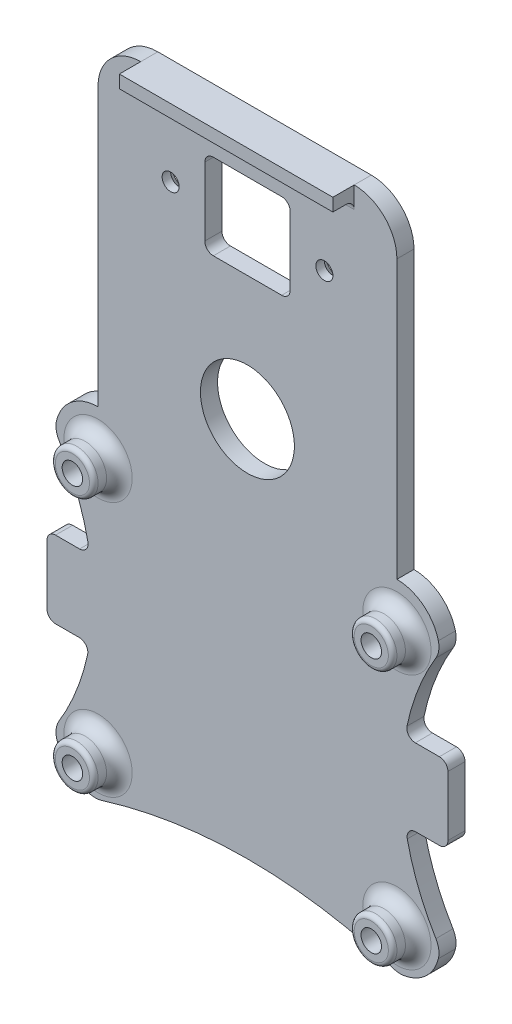
from build123d import *

# Parameters (mm, degrees)
SKETCH1_R           = 2.4
BOSS_EXTRUDE1_DEPTH = 4
SKETCH2_R           = 5.004606442
SKETCH2_R_2         = 2.4
SKETCH2_R_3         = 5
BOSS_EXTRUDE2_DEPTH = 6
FILLET1_R           = 3
FILLET2_R           = 1
FILLET3_R           = 5
BOSS_EXTRUDE3_DEPTH = 4
CUT_EXTRUDE1_REACH  = 126.617
SKETCH4_R           = 2
SKETCH4_R_2         = 11
CHAMFER2_SIZE       = 2
SKETCH5_W           = 50
SKETCH5_H           = 3
BOSS_EXTRUDE4_DEPTH = 5
FILLET4_R           = 2


with BuildPart() as part:
    # Sketch1 → Boss-Extrude1 (new body)
    with BuildSketch(Plane.XY):
        with BuildLine():
            Line((-35, 40), (35, 40))
            ThreePointArc((35, 40), (42.071067812, 37.071067812), (45, 30))
            ThreePointArc((45, 30), (40.324654416, 21.056464988), (37.362127592, 11.409231724))
            ThreePointArc((37.362127592, 11.409231724), (37.76764229, 9.738743374), (39.319812295, 9))
            Line((39.319812295, 9), (44.95, 9))
            ThreePointArc((44.95, 9), (46.364213562, 8.414213562), (46.95, 7))
            Line((46.95, 7), (46.95, -7))
            ThreePointArc((46.95, -7), (46.364213562, -8.414213562), (44.95, -9))
            Line((44.95, -9), (39.385736873, -9))
            ThreePointArc((39.385736873, -9), (37.829794408, -9.743400205), (37.43053989, -11.420956955))
            ThreePointArc((37.43053989, -11.420956955), (40.387514205, -20.898098851), (45, -29.689281388))
            ThreePointArc((45, -29.689281388), (42.158200619, -36.675130552), (35.244966425, -39.689281388))
            ThreePointArc((35.244966425, -39.689281388), (0.122483213, -34.194583419), (-35, -39.689281388))
            ThreePointArc((-35, -39.689281388), (-42.071067812, -36.7603492), (-45, -29.689281388))
            ThreePointArc((-45, -29.689281388), (-40.387514205, -20.898098851), (-37.43053989, -11.420956955))
            ThreePointArc((-37.43053989, -11.420956955), (-37.829794408, -9.743400205), (-39.385736873, -9))
            Line((-39.385736873, -9), (-44.95, -9))
            ThreePointArc((-44.95, -9), (-46.364213562, -8.414213562), (-46.95, -7))
            Line((-46.95, -7), (-46.95, 7))
            ThreePointArc((-46.95, 7), (-46.364213562, 8.414213562), (-44.95, 9))
            Line((-44.95, 9), (-39.319812295, 9))
            ThreePointArc((-39.319812295, 9), (-37.76764229, 9.738743374), (-37.362127592, 11.409231724))
            ThreePointArc((-37.362127592, 11.409231724), (-40.324654416, 21.056464988), (-45, 30))
            ThreePointArc((-45, 30), (-42.071067812, 37.071067812), (-35, 40))
        make_face()
        with Locations((-35, 29.5)):
            Circle(SKETCH1_R, mode=Mode.SUBTRACT)
        with Locations((35, 29.5)):
            Circle(SKETCH1_R, mode=Mode.SUBTRACT)
        with Locations((-35, -30.3)):
            Circle(SKETCH1_R, mode=Mode.SUBTRACT)
        with Locations((35, -30.3)):
            Circle(SKETCH1_R, mode=Mode.SUBTRACT)
    extrude(amount=BOSS_EXTRUDE1_DEPTH)

    # Sketch2 → Boss-Extrude2 (add)
    # profile 1 of 4: a face of its own
    with BuildSketch(Plane.XY.offset(4)):
        with Locations(Location((-35, 29.5, 0), (0, 0, 180))):
            Circle(SKETCH2_R)
        with Locations((-35, 29.5)):
            Circle(SKETCH2_R_2, mode=Mode.SUBTRACT)
    # profile 2 of 4: a face of its own
    with BuildSketch(Plane.XY.offset(4)):
        with Locations(Location((35, 29.5, 0), (0, 0, 180))):
            Circle(SKETCH2_R_3)
        with Locations((35, 29.5)):
            Circle(SKETCH2_R_2, mode=Mode.SUBTRACT)
    # profile 3 of 4: a face of its own
    with BuildSketch(Plane.XY.offset(4)):
        with Locations(Location((-35, -30.3, 0), (0, 0, 180))):
            Circle(SKETCH2_R_3)
        with Locations((-35, -30.3)):
            Circle(SKETCH2_R_2, mode=Mode.SUBTRACT)
    # profile 4 of 4: a face of its own
    with BuildSketch(Plane.XY.offset(4)):
        with Locations(Location((35, -30.3, 0), (0, 0, 180))):
            Circle(SKETCH2_R_3)
        with Locations((35, -30.3)):
            Circle(SKETCH2_R_2, mode=Mode.SUBTRACT)
    extrude(amount=BOSS_EXTRUDE2_DEPTH)

    # Fillet1
    fillet1_edges = [part.edges().sort_by_distance(p)[0] for p in [
        (-29.995393558, 29.5, 4),
        (40, 29.5, 4),
        (-30, -30.3, 4),
        (40, -30.3, 4),
    ]]
    fillet(fillet1_edges, radius=FILLET1_R)

    # Fillet2
    fillet2_edges = [part.edges().sort_by_distance(p)[0] for p in [
        (-29.995393558, 29.5, 10),
        (40, 29.5, 10),
        (-30, -30.3, 10),
        (40, -30.3, 10),
    ]]
    fillet(fillet2_edges, radius=FILLET2_R)

    # Fillet3
    fillet3_edges = [part.edges().sort_by_distance(p)[0] for p in [
        (45, 30, 2),
        (45, -29.689281388, 2),
        (35.244966425, -39.689281388, 2),
        (-35, -39.689281388, 2),
        (-45, -29.689281388, 2),
        (-45, 30, 2),
    ]]
    fillet(fillet3_edges, radius=FILLET3_R)

    # Sketch3 → Boss-Extrude3 (add)
    with BuildSketch(Plane(origin=(0, 0, 0), x_dir=(-1, 0, 0), z_dir=(0, 0, -1))):
        with BuildLine():
            Line((-35, 40), (35, 40))
            Line((35, 40), (35, 105))
            ThreePointArc((35, 105), (32.071067812, 112.071067812), (25, 115))
            Line((25, 115), (-25, 115))
            ThreePointArc((-25, 115), (-32.071067812, 112.071067812), (-35, 105))
            Line((-35, 105), (-35, 40))
        make_face()
    extrude(amount=-BOSS_EXTRUDE3_DEPTH)

    # Sketch4 → Cut-Extrude1 (cut, up to next)
    with BuildSketch(Plane(origin=(0, 0, 0), x_dir=(-1, 0, 0), z_dir=(0, 0, -1)), mode=Mode.PRIVATE) as cut_extrude1_sk1:
        with Locations((-18.012077439, 94.13)):
            Circle(SKETCH4_R)
    cut_extrude1_tool1 = extrude(cut_extrude1_sk1.sketch, amount=-CUT_EXTRUDE1_REACH, mode=Mode.PRIVATE) & part.part
    # Sketch4 → Cut-Extrude1 (cut, up to next)
    with BuildSketch(Plane(origin=(0, 0, 0), x_dir=(-1, 0, 0), z_dir=(0, 0, -1)), mode=Mode.PRIVATE) as cut_extrude1_sk2:
        with Locations((17.987922561, 94.13)):
            Circle(SKETCH4_R)
    cut_extrude1_tool2 = extrude(cut_extrude1_sk2.sketch, amount=-CUT_EXTRUDE1_REACH, mode=Mode.PRIVATE) & part.part
    # Sketch4 → Cut-Extrude1 (cut, up to next)
    with BuildSketch(Plane(origin=(0, 0, 0), x_dir=(-1, 0, 0), z_dir=(0, 0, -1)), mode=Mode.PRIVATE) as cut_extrude1_sk3:
        with Locations((0.010567412, 54.999350628)):
            Circle(SKETCH4_R_2)
    cut_extrude1_tool3 = extrude(cut_extrude1_sk3.sketch, amount=-CUT_EXTRUDE1_REACH, mode=Mode.PRIVATE) & part.part
    # Sketch4 → Cut-Extrude1 (cut, up to next)
    with BuildSketch(Plane(origin=(0, 0, 0), x_dir=(-1, 0, 0), z_dir=(0, 0, -1)), mode=Mode.PRIVATE) as cut_extrude1_sk4:
        with BuildLine():
            Line((-8.012077439, 84.13), (7.987922561, 84.13))
            ThreePointArc((7.987922561, 84.13), (9.402136123, 84.715786438), (9.987922561, 86.13))
            Line((9.987922561, 86.13), (9.987922561, 102.13))
            ThreePointArc((9.987922561, 102.13), (9.402136123, 103.544213562), (7.987922561, 104.13))
            Line((7.987922561, 104.13), (-8.012077439, 104.13))
            ThreePointArc((-8.012077439, 104.13), (-9.426291001, 103.544213562), (-10.012077439, 102.13))
            Line((-10.012077439, 102.13), (-10.012077439, 86.13))
            ThreePointArc((-10.012077439, 86.13), (-9.426291001, 84.715786438), (-8.012077439, 84.13))
        make_face()
    cut_extrude1_tool4 = extrude(cut_extrude1_sk4.sketch, amount=-CUT_EXTRUDE1_REACH, mode=Mode.PRIVATE) & part.part
    add(cut_extrude1_tool1.solids().sort_by_distance((18.012077, 94.13, 0))[0], mode=Mode.SUBTRACT)
    add(cut_extrude1_tool2.solids().sort_by_distance((-17.987923, 94.13, 0))[0], mode=Mode.SUBTRACT)
    add(cut_extrude1_tool3.solids().sort_by_distance((-0.010567, 54.999351, 0))[0], mode=Mode.SUBTRACT)
    add(cut_extrude1_tool4.solids().sort_by_distance((0.012077, 94.13, 0))[0], mode=Mode.SUBTRACT)

    # Chamfer2
    chamfer2_edges = [part.edges().sort_by_distance(p)[0] for p in [
        (20.012077439, 94.13, 0),
        (-15.987922561, 94.13, 0),
    ]]
    chamfer(chamfer2_edges, length=CHAMFER2_SIZE)

    # Sketch5 → Boss-Extrude4 (add)
    with BuildSketch(Plane.XY.offset(4)):
        with Locations((0, 113.5)):
            Rectangle(SKETCH5_W, SKETCH5_H)
    extrude(amount=BOSS_EXTRUDE4_DEPTH)

    # Fillet4
    fillet4_edges = [part.edges().sort_by_distance(p)[0] for p in [
        (0, 112, 4),
    ]]
    fillet(fillet4_edges, radius=FILLET4_R)


solid = part.part
